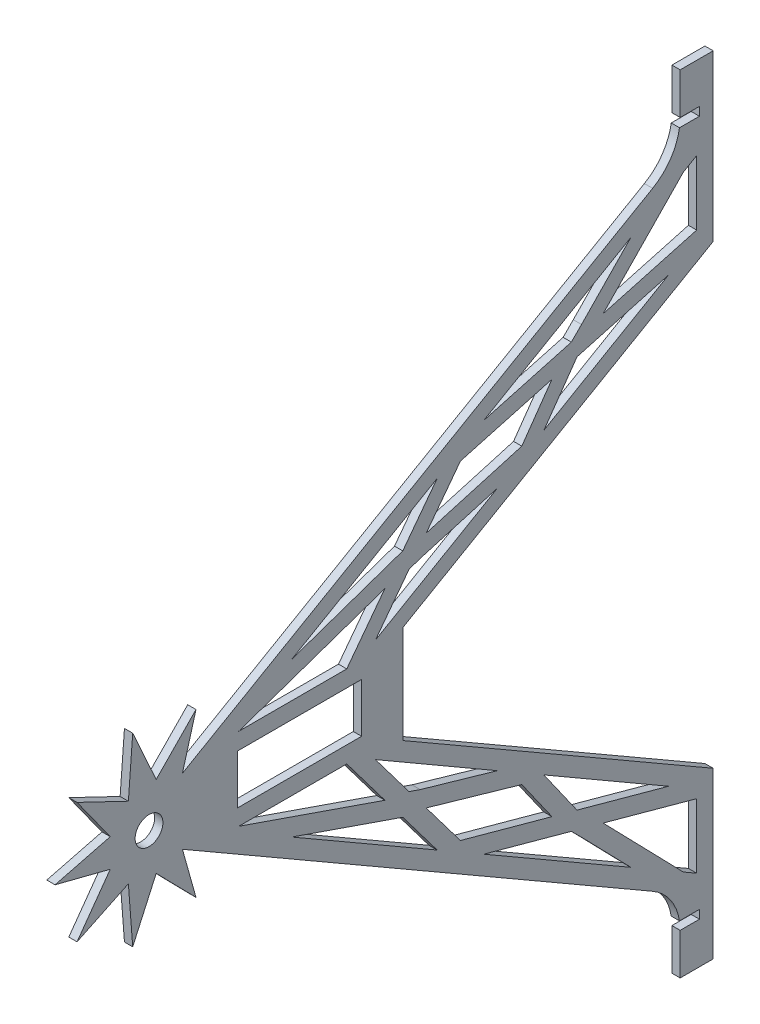
from build123d import *

# Parameters (mm, degrees)
SKETCH1_R                      = 4.95
SKETCH1_W                      = 17.9
SKETCH1_H                      = 45.1
BOSS_EXTRUDE1_DEPTH            = 3
CUT_EXTRUDE1_DEPTH             = 251.790202921
CUT_EXTRUDE1_DEPTH_BACK        = 251.790202921
SKETCH2_W                      = 258.160615752
SKETCH2_H                      = 10
SKETCH3_W                      = 12
SKETCH3_H                      = 60
BOSS_EXTRUDE2_DEPTH            = 3
FILLET1_R                      = 20
BOSS_EXTRUDE3_START            = -3
BOSS_EXTRUDE3_DEPTH            = 3
CIRPATTERN1_COUNT              = 9
SKETCH5_W                      = 17
SKETCH5_H                      = 3.1
CUT_EXTRUDE2_DEPTH             = 250.90439271
CUT_EXTRUDE3_DEPTH             = 250.90439271
MAIN_SHAFT_CLEARANCE_PROFILE_R = 5.05
SHAFT_CLEARANCE_10P1_DEPTH     = 250.90439271


with BuildPart() as part:
    # Sketch1 → Boss-Extrude1 (new body)
    with BuildSketch(Plane.YZ):
        with BuildLine():
            Line((-10.899695646, -10.305175148), (-129.080307876, -215))
            Line((-129.080307876, -215), (-88.665789032, -215))
            Line((-88.665789032, -215), (-17.790269987, -92.24))
            Line((-17.790269987, -92.24), (17.790269987, -92.24))
            Line((17.790269987, -92.24), (88.665789032, -215))
            Line((88.665789032, -215), (129.080307876, -215))
            Line((129.080307876, -215), (10.899695646, -10.305175148))
            ThreePointArc((10.899695646, -10.305175148), (0, 15), (-10.899695646, -10.305175148))
        make_face()
        Circle(SKETCH1_R, mode=Mode.SUBTRACT)
        with Locations((0, -54.69)):
            Rectangle(SKETCH1_W, SKETCH1_H, mode=Mode.SUBTRACT)
    extrude(amount=BOSS_EXTRUDE1_DEPTH)

    # Sketch2 → Cut-Extrude1 (cut, two sides: drawn at the far end of the back side and taken through both)
    with BuildSketch(Plane.YZ.offset(3).offset(-CUT_EXTRUDE1_DEPTH_BACK)):
        with Locations((0, -210)):
            Rectangle(SKETCH2_W, SKETCH2_H)
    extrude(amount=CUT_EXTRUDE1_DEPTH + CUT_EXTRUDE1_DEPTH_BACK, mode=Mode.SUBTRACT)

    # Sketch3 → Boss-Extrude2 (add)
    with BuildSketch(Plane(origin=(3, 0, 0), x_dir=(0, 0, -1), z_dir=(1, 0, 0))):
        with Locations((199, -112.892286341)):
            Rectangle(SKETCH3_W, SKETCH3_H)
        with Locations((199, 112.892286341)):
            Rectangle(SKETCH3_W, SKETCH3_H)
    extrude(amount=-BOSS_EXTRUDE2_DEPTH)

    # Fillet1
    fillet1_edges = [part.edges().sort_by_distance(p)[0] for p in [
        (1.5, 116.378601954, -193),
        (1.5, -116.378601954, -193),
    ]]
    fillet(fillet1_edges, radius=FILLET1_R)

    # Sketch4 → Boss-Extrude3 (add)
    with BuildSketch(Plane(origin=(3, 0, 0), x_dir=(0, 0, -1), z_dir=(1, 0, 0)).offset(BOSS_EXTRUDE3_START)):
        with BuildLine():
            Line((-34.137962787, 0), (-14.095389312, -5.13030215))
            ThreePointArc((-14.095389312, -5.13030215), (-15, 0), (-14.095389312, 5.13030215))
            Line((-14.095389312, 5.13030215), (-34.137962787, 0))
        make_face()
    boss_extrude3 = extrude(amount=BOSS_EXTRUDE3_DEPTH)

    # CirPattern1: Boss-Extrude3 ×9 about axis
    cirpattern1_axis = Axis((-0.1501615, 0, 0), (1, 0, 0))
    for i in range(1, CIRPATTERN1_COUNT):
        add(boss_extrude3.rotate(cirpattern1_axis, i * 360 / CIRPATTERN1_COUNT))

    # Sketch5 → Cut-Extrude2 (cut, symmetric)
    with BuildSketch(Plane(origin=(3, 0, 0), x_dir=(0, 0, -1), z_dir=(1, 0, 0))):
        with Locations((191.5, -126.342286341)):
            Rectangle(SKETCH5_W, SKETCH5_H)
    cut_extrude2 = extrude(amount=CUT_EXTRUDE2_DEPTH, both=True, mode=Mode.SUBTRACT)

    # Mirror1: Cut-Extrude2 across plane
    add(cut_extrude2.mirror(Plane.ZX), mode=Mode.SUBTRACT)

    # Sketch6 → Cut-Extrude3 (cut, symmetric)
    with BuildSketch(Plane.YZ.offset(3)):
        Polygon((-44.440620352, -126.565865893), (-18.81339339, -82.279763058), (-34.966746745, -94.476691336), (-36.374058239, -98.54606889), align=None)
        Polygon((-33.320603167, -85.715441185), (-14.95, -71.844331927), (-14.95, -32.59506202), align=None)
        Polygon((-80.442842118, -188.780872527), (-54.234238638, -143.490099921), (-71.318419935, -155.512353255), align=None)
        Polygon((-41.912952433, -92.203274728), (-27.957868434, -51.850797102), (-58.475794969, -104.709396402), align=None)
        Polygon((-112.914500338, -199), (-89.467175046, -199), (-80.146284863, -165.015139537), (-110.110561046, -194.143434684), align=None)
        Polygon((-76.978433226, -153.464848336), (-68.249306861, -121.637615567), (-99.099637478, -175.071955626), (-80.672732205, -157.159147315), align=None)
        Polygon((-43.245914121, -100.728050325), (-59.700544534, -113.152464165), (-68.824966717, -146.420983438), (-53.243788825, -135.456403713), align=None)
    cut_extrude3 = extrude(amount=CUT_EXTRUDE3_DEPTH, both=True, mode=Mode.SUBTRACT)

    # Mirror2: Cut-Extrude3 across plane
    add(cut_extrude3.mirror(Plane.ZX), mode=Mode.SUBTRACT)

    # Main_shaft_clearance_profile → Shaft_clearance_10p1 (cut, through all)
    with BuildSketch(Plane.YZ):
        Circle(MAIN_SHAFT_CLEARANCE_PROFILE_R)
    extrude(amount=SHAFT_CLEARANCE_10P1_DEPTH, mode=Mode.SUBTRACT)


solid = part.part
